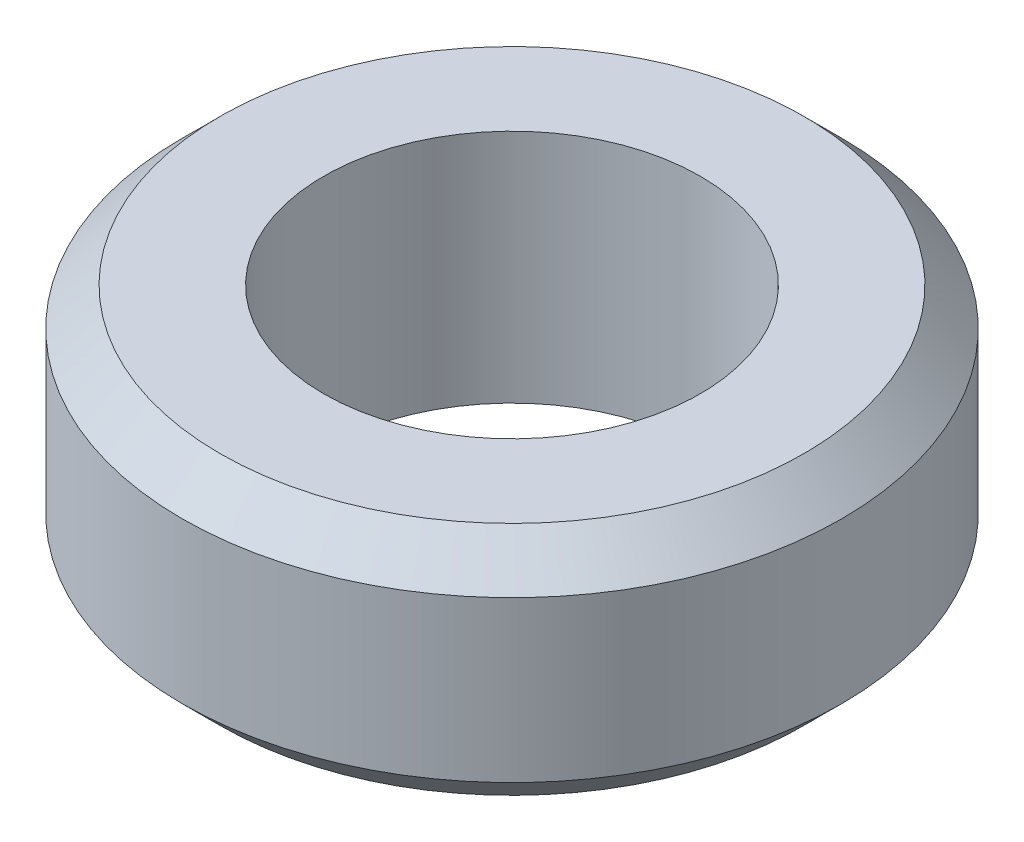
from build123d import *

# Parameters (mm, degrees)
SKETCH_1_R      = 3.5
SKETCH_1_R_2    = 2
EXTRUDE_1_DEPTH = 2.5
CHAMFER_1_SIZE  = 0.4


with BuildPart() as part:
    # 草图1 → 凸台-拉伸1 (new body)
    with BuildSketch(Plane(origin=(0, 0, 0), x_dir=(1, 0, 0), z_dir=(0, 1, 0))):
        with Locations(Location((0, 0, 0), (0, 0, 270))):
            Circle(SKETCH_1_R)
        with Locations(Location((0, 0, 0), (0, 0, 270))):
            Circle(SKETCH_1_R_2, mode=Mode.SUBTRACT)
    extrude(amount=EXTRUDE_1_DEPTH)

    # 倒角1
    chamfer_1_edges = [part.edges().sort_by_distance(p)[0] for p in [
        (0, 0, -3.5),
        (0, 2.5, -3.5),
    ]]
    chamfer(chamfer_1_edges, length=CHAMFER_1_SIZE)


solid = part.part
